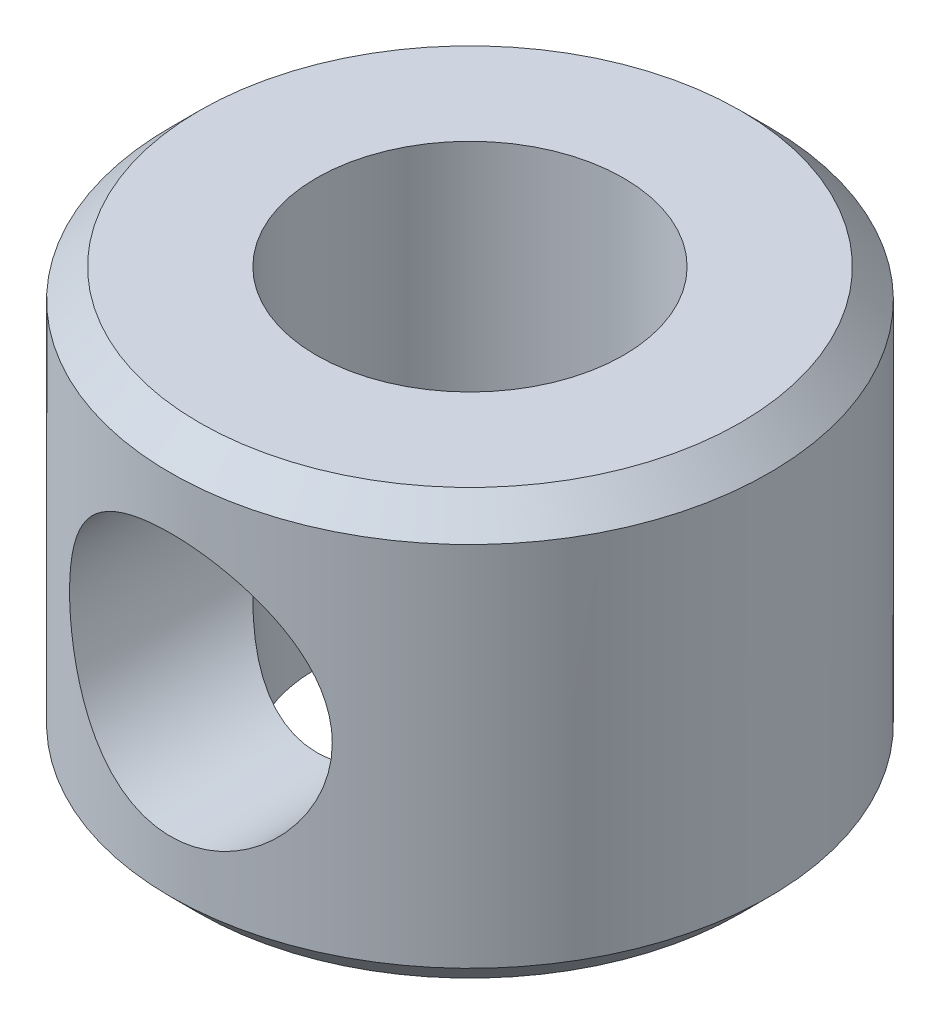
from build123d import *

# Parameters (mm, degrees)
SKETCH1_R                  = 3.937
SKETCH1_R_2                = 2.0193
BOSS_EXTRUDE1_DEPTH        = 5.588
F_8_32_TAPPED_HOLE1_REACH  = 11.236
F_8_32_TAPPED_HOLE1_BORE_R = 1.7272
CHAMFER1_SIZE              = 0.381


with BuildPart() as part:
    # Sketch1 → Boss-Extrude1 (new body)
    with BuildSketch(Plane(origin=(0, 0, 0), x_dir=(1, 0, 0), z_dir=(0, 1, 0))):
        with Locations(Location((0, 0, 0), (0, 0, 270))):
            Circle(SKETCH1_R)
        with Locations(Location((0, 0, 0), (0, 0, 270))):
            Circle(SKETCH1_R_2, mode=Mode.SUBTRACT)
    extrude(amount=BOSS_EXTRUDE1_DEPTH)

    # #8-32 Tapped Hole1 bore (on position points) → #8-32 Tapped Hole1 (cut, up to next)
    with BuildSketch(Plane(origin=(0, 2.794, 3.937), x_dir=(1, 0, 0), z_dir=(0, 0, 1)), mode=Mode.PRIVATE) as f_8_32_tapped_hole1_sk1:
        Circle(F_8_32_TAPPED_HOLE1_BORE_R)
    f_8_32_tapped_hole1_tool1 = extrude(f_8_32_tapped_hole1_sk1.sketch, amount=-F_8_32_TAPPED_HOLE1_REACH, mode=Mode.PRIVATE) & part.part
    add(f_8_32_tapped_hole1_tool1.solids().sort_by_distance((0, 2.794, 3.937))[0], mode=Mode.SUBTRACT)

    # Chamfer1
    chamfer1_edges = [part.edges().sort_by_distance(p)[0] for p in [
        (0, 0, -3.937),
        (0, 5.588, -3.937),
    ]]
    chamfer(chamfer1_edges, length=CHAMFER1_SIZE)


solid = part.part
